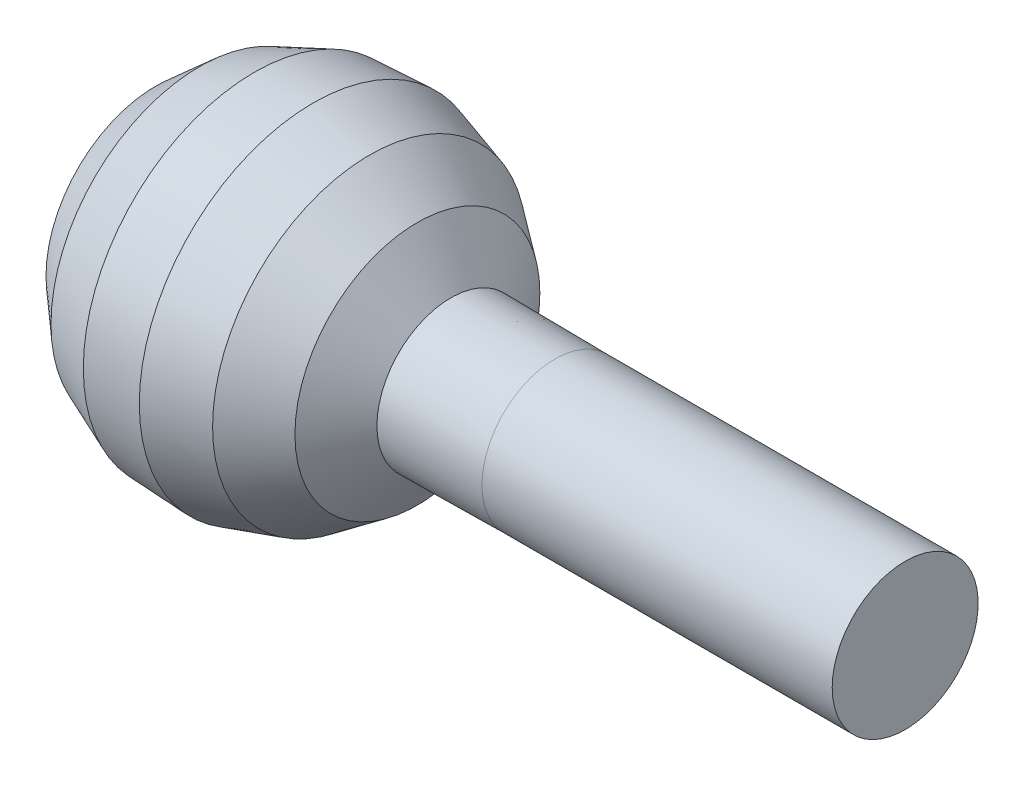
from build123d import *


with BuildPart() as part:
    # Ball_Stud Sketch → Ball_Stud (revolve)
    with BuildSketch(Plane.XY):
        Polygon((-7.5, 0), (-7.330102502, 0.995248625), (-6.839653449, 1.877770417), (-6.084203552, 2.547606545), (-5.149318842, 2.928888021), (-4.140889034, 2.978429001), (-3.173133929, 2.690618225), (-2.355666308, 2.098054579), (-1.781076639, 1.267854785), (0, 1.25), (6, 1.25), (6, 0), align=None)
    revolve(axis=Axis((-1000, 0, 0), (1, 0, 0)))


solid = part.part
